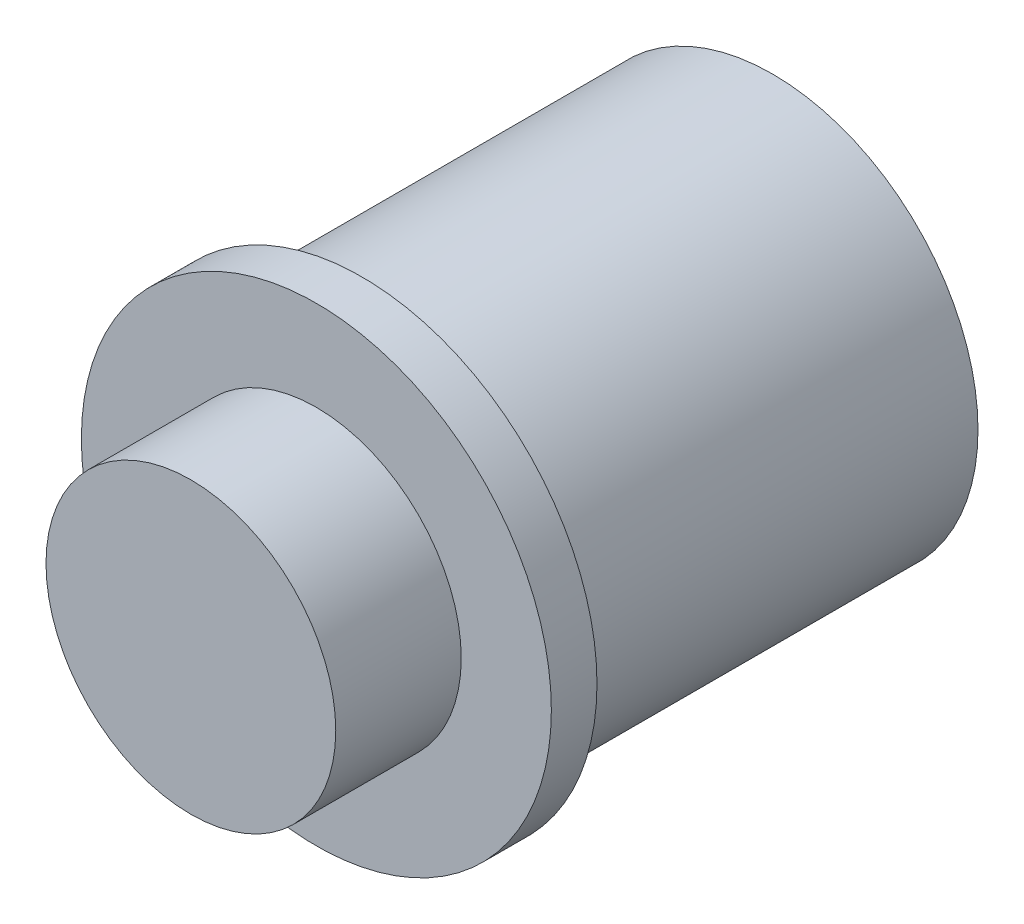
from build123d import *

# Parameters (mm, degrees)
SKETCH1_R           = 9
BOSS_EXTRUDE1_DEPTH = 18
SKETCH2_R           = 10.3
BOSS_EXTRUDE2_DEPTH = 2
SKETCH3_R           = 6.35
BOSS_EXTRUDE3_DEPTH = 5.5


with BuildPart() as part:
    # Sketch1 → Boss-Extrude1 (new body)
    with BuildSketch(Plane.XY):
        Circle(SKETCH1_R)
    extrude(amount=BOSS_EXTRUDE1_DEPTH)

    # Sketch2 → Boss-Extrude2 (add)
    with BuildSketch(Plane.XY.offset(18)):
        Circle(SKETCH2_R)
    extrude(amount=BOSS_EXTRUDE2_DEPTH)

    # Sketch3 → Boss-Extrude3 (add)
    with BuildSketch(Plane.XY.offset(20)):
        Circle(SKETCH3_R)
    extrude(amount=BOSS_EXTRUDE3_DEPTH)


solid = part.part
